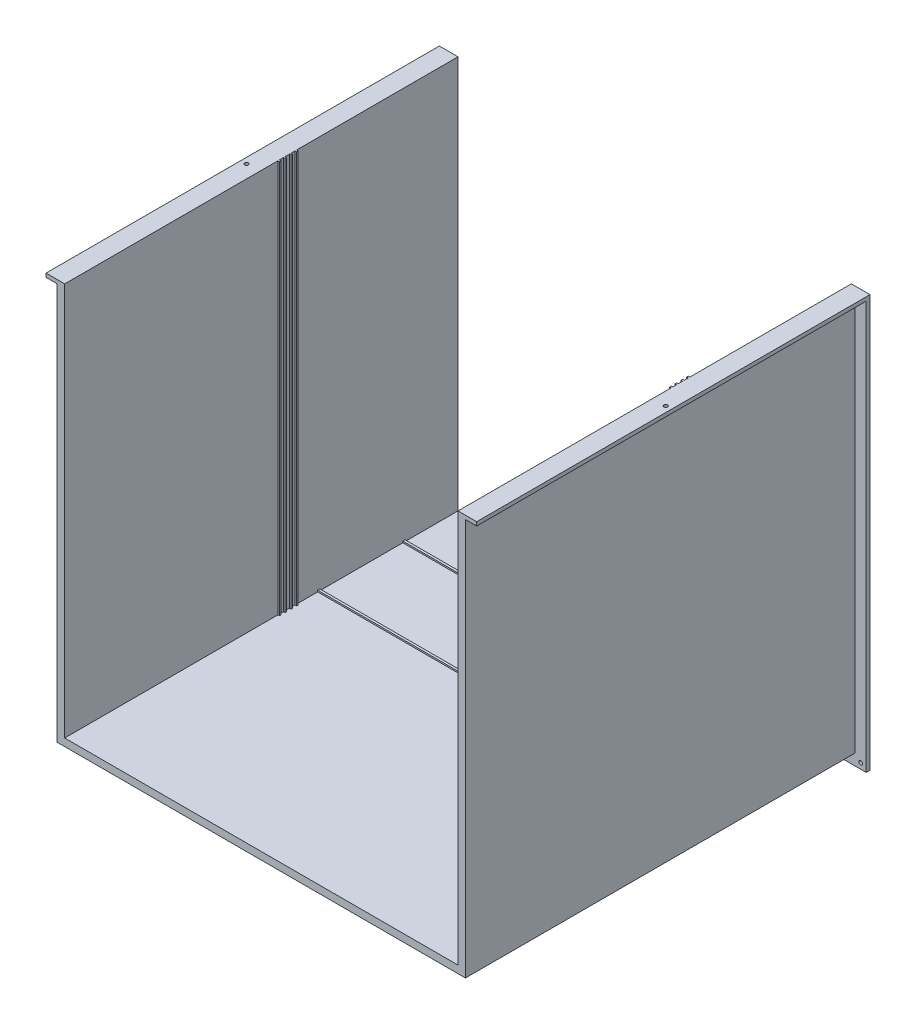
from build123d import *

# Parameters (mm, degrees)
BOSS_EXTRUDE1_DEPTH = 526.6975777
SKETCH2_W           = 526.6975777
SKETCH2_H           = 3
BOSS_EXTRUDE2_DEPTH = 2
SKETCH3_W           = 2.2
SKETCH3_H           = 2
BOSS_EXTRUDE3_DEPTH = 526.6975777
SKETCH4_R           = 2.5
BOSS_EXTRUDE4_DEPTH = 5
SKETCH5_W           = 15
SKETCH5_H           = 521.6975777
SKETCH5_R           = 2.5
BOSS_EXTRUDE5_DEPTH = 5


with BuildPart() as part:
    # Sketch1 → Boss-Extrude1 (new body)
    with BuildSketch(Plane.XY):
        Polygon((-263.34878885, -263.34878885), (263.34878885, -263.34878885), (263.34878885, 263.34878885), (273.34878885, 263.34878885), (273.34878885, -273.34878885), (-273.34878885, -273.34878885), (-273.34878885, 263.34878885), (-263.34878885, 263.34878885), align=None)
    extrude(amount=BOSS_EXTRUDE1_DEPTH)

    # Sketch2 → Boss-Extrude2 (add)
    with BuildSketch(Plane(origin=(0, -263.34878885, 0), x_dir=(1, 0, 0), z_dir=(0, 1, 0))):
        with Locations((0, -72.401892101)):
            Rectangle(SKETCH2_W, SKETCH2_H)
        with Locations((0, -186.401892101)):
            Rectangle(SKETCH2_W, SKETCH2_H)
    extrude(amount=BOSS_EXTRUDE2_DEPTH)

    # Sketch3 → Boss-Extrude3 (add)
    with BuildSketch(Plane(origin=(0, -263.34878885, 0), x_dir=(1, 0, 0), z_dir=(0, 1, 0))):
        with Locations((-262.24878885, -217.20163133)):
            Rectangle(SKETCH3_W, SKETCH3_H)
        with Locations((-262.24878885, -224.70163133)):
            Rectangle(SKETCH3_W, SKETCH3_H)
        with Locations((262.24878885, -224.70163133)):
            Rectangle(SKETCH3_W, SKETCH3_H)
        with Locations((262.24878885, -217.20163133)):
            Rectangle(SKETCH3_W, SKETCH3_H)
    boss_extrude3 = extrude(amount=BOSS_EXTRUDE3_DEPTH)

    # Mirror1: Boss-Extrude3 across plane
    add(boss_extrude3.mirror(Plane.XY.offset(228.70163133)))

    # Sketch4 → Boss-Extrude4 (add)
    with BuildSketch(Plane(origin=(0, 0, 0), x_dir=(-1, 0, 0), z_dir=(0, 0, -1))):
        Polygon((-263.34878885, 263.34878885), (-263.34878885, -263.34878885), (263.34878885, -263.34878885), (263.34878885, 263.34878885), (288.34878885, 263.34878885), (288.34878885, -288.34878885), (-288.34878885, -288.34878885), (-288.34878885, 263.34878885), align=None)
        with Locations((-280.84878885, -280.84878885)):
            Circle(SKETCH4_R, mode=Mode.SUBTRACT)
        with Locations((280.84878885, -280.84878885)):
            Circle(SKETCH4_R, mode=Mode.SUBTRACT)
    extrude(amount=-BOSS_EXTRUDE4_DEPTH)

    # Sketch5 → Boss-Extrude5 (add)
    # profile 1 of 2: a face of its own
    with BuildSketch(Plane(origin=(0, 263.34878885, 0), x_dir=(1, 0, 0), z_dir=(0, 1, 0))):
        with Locations((-280.84878885, -265.84878885)):
            Rectangle(SKETCH5_W, SKETCH5_H)
        with Locations(Location((-280.704595135, -265.84878885, 0), (0, 0, 270))):
            Circle(SKETCH5_R, mode=Mode.SUBTRACT)
    # profile 2 of 2: a face of its own
    with BuildSketch(Plane(origin=(0, 263.34878885, 0), x_dir=(1, 0, 0), z_dir=(0, 1, 0))):
        with Locations((280.84878885, -265.84878885)):
            Rectangle(SKETCH5_W, SKETCH5_H)
        with Locations(Location((280.704595135, -265.84878885, 0), (0, 0, 90))):
            Circle(SKETCH5_R, mode=Mode.SUBTRACT)
    extrude(amount=-BOSS_EXTRUDE5_DEPTH)


solid = part.part
